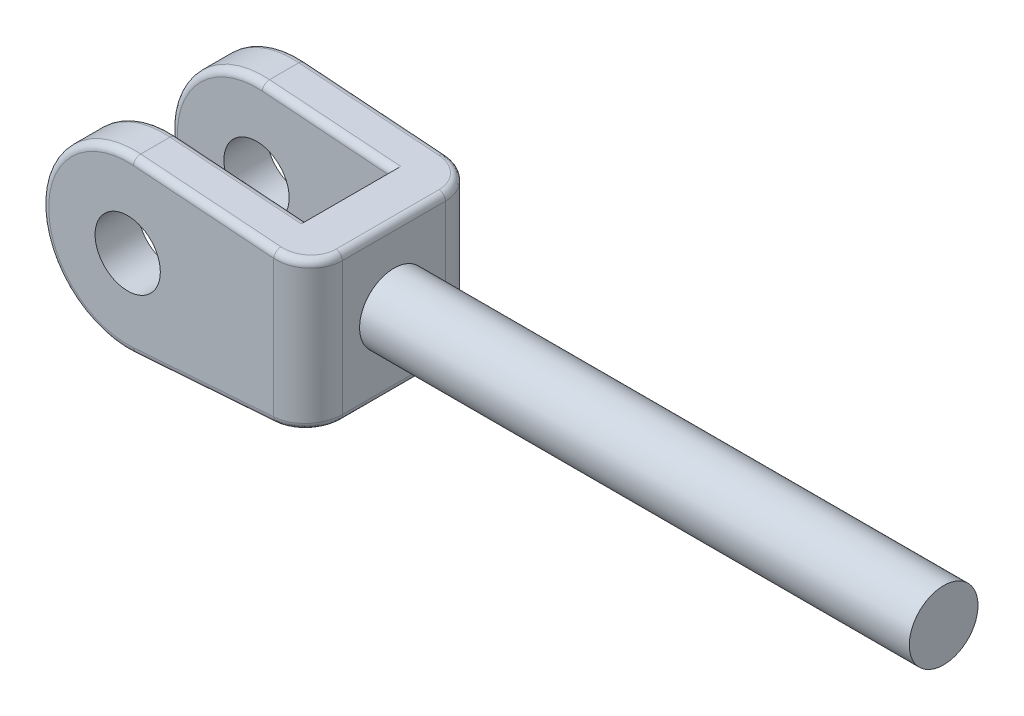
from build123d import *

# Parameters (mm, degrees)
SKETCH2_R               = 1
BOSS_EXTRUDE1_DEPTH     = 16
SKETCH3_R               = 0.95
BOSS_EXTRUDE2_DEPTH     = 2.5
CUT_EXTRUDE1_DEPTH      = 17.385969608
CUT_EXTRUDE1_DEPTH_BACK = 17.385969608
SKETCH4_W               = 6.5
SKETCH4_H               = 2.5
FILLET1_R               = 1
FILLET2_R               = 0.2
FILLET3_R               = 0.2
FILLET4_R               = 0.2


with BuildPart() as part:
    # Sketch2 → Boss-Extrude1 (new body)
    with BuildSketch(Plane(origin=(0, 0, 0), x_dir=(0, 0, -1), z_dir=(1, 0, 0))):
        Circle(SKETCH2_R)
    extrude(amount=BOSS_EXTRUDE1_DEPTH)

    # Sketch3 → Boss-Extrude2 (add, symmetric)
    with BuildSketch(Plane.XY):
        with BuildLine():
            Line((0, -2.125), (0, 2.125))
            Line((0, 2.125), (-5.06876613, 2.493422203))
            ThreePointArc((-5.06876613, 2.493422203), (-7.75, 0), (-5.06876613, -2.493422203))
            Line((-5.06876613, -2.493422203), (0, -2.125))
        make_face()
        with Locations((-5.25, 0)):
            Circle(SKETCH3_R, mode=Mode.SUBTRACT)
    extrude(amount=BOSS_EXTRUDE2_DEPTH, both=True)

    # Sketch4 → Cut-Extrude1 (cut, two sides: drawn at the far end of the back side and taken through both)
    with BuildSketch(Plane(origin=(0, 0, 0), x_dir=(1, 0, 0), z_dir=(0, 1, 0)).offset(-CUT_EXTRUDE1_DEPTH_BACK)):
        with Locations((-4.5, 0)):
            Rectangle(SKETCH4_W, SKETCH4_H)
    extrude(amount=CUT_EXTRUDE1_DEPTH + CUT_EXTRUDE1_DEPTH_BACK, mode=Mode.SUBTRACT)

    # Fillet1
    fillet1_edges = [part.edges().sort_by_distance(p)[0] for p in [
        (0, 0, 2.5),
        (0, 0, -2.5),
    ]]
    fillet(fillet1_edges, radius=FILLET1_R)

    # Fillet2
    fillet2_edges = [part.edges().sort_by_distance(p)[0] for p in [
        (0, 2.125, 0),
        (0, -2.125, 0),
        (-3.034383065, 2.345553497, 2.5),
        (-3.034383065, 2.345553497, -2.5),
        (-0.293359104, 2.146322745, 2.20757236),
        (-0.293359104, 2.146322745, -2.20757236),
        (-0.293359104, -2.146322745, 2.20757236),
        (-0.293359104, -2.146322745, -2.20757236),
        (-3.034383065, -2.345553497, 2.5),
        (-7.75, 0, 2.5),
        (-3.034383065, -2.345553497, -2.5),
        (-7.75, 0, -2.5),
    ]]
    fillet(fillet2_edges, radius=FILLET2_R)

    # Fillet3
    fillet3_edges = [part.edges().sort_by_distance(p)[0] for p in [
        (-7.75, 0, -1.25),
        (-3.159383065, 2.354639096, -1.25),
        (-3.159383065, -2.354639096, -1.25),
    ]]
    fillet(fillet3_edges, radius=FILLET3_R)

    # Fillet4
    fillet4_edges = [part.edges().sort_by_distance(p)[0] for p in [
        (-7.75, 0, 1.25),
        (-3.159383065, -2.354639096, 1.25),
        (-3.159383065, 2.354639096, 1.25),
    ]]
    fillet(fillet4_edges, radius=FILLET4_R)


solid = part.part
